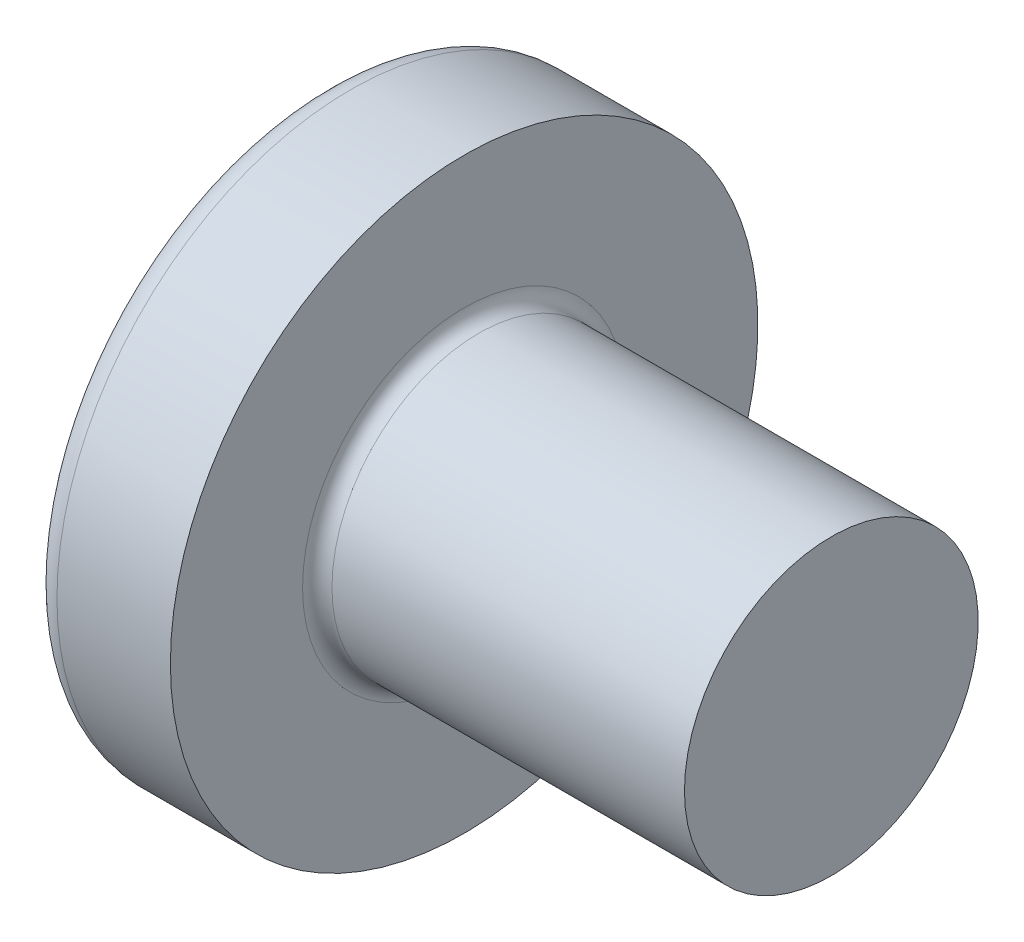
from build123d import *

# Parameters (mm, degrees)
FILLET1_R    = 0.2
RECPAT_COUNT = 2
RECPAT_ANGLE = 90


with BuildPart() as part:
    # BodySke → Base-Revolve (revolve)
    with BuildSketch(Plane.XY, mode=Mode.PRIVATE) as base_revolve_sk:
        with BuildLine():
            Line((3.1, 2), (3.1, 4))
            Line((3.1, 4), (1.555305874, 4))
            ThreePointArc((1.555305874, 4), (1.392873227, 3.961271902), (1.265388955, 3.853420195))
            ThreePointArc((1.265388955, 3.853420195), (0.324444487, 2.027933456), (0, 0))
            Line((0, 0), (8.1, 0))
            Line((8.1, 0), (8.1, 2))
            Line((8.1, 2), (3.1, 2))
        make_face()
    revolve(base_revolve_sk.sketch.rotate(Axis((1.555305874, 0, 0), (1, 0, 0)), 90), axis=Axis((1.555305874, 0, 0), (1, 0, 0)))

    # Fillet1
    fillet1_edges = [part.edges().sort_by_distance(p)[0] for p in [
        (3.1, 0, -2),
    ]]
    fillet(fillet1_edges, radius=FILLET1_R)

    # Sketch3 → Recess section 0
    with BuildSketch(Plane(origin=(0, 0, 0), x_dir=(0, 0, -1), z_dir=(1, 0, 0))):
        with BuildLine():
            Line((0.515, -2.15), (-0.515, -2.15))
            Line((-0.515, -2.15), (-0.515, 2.15))
            Line((-0.515, 2.15), (0.515, 2.15))
            Line((0.515, 2.15), (0.515, -2.15))
        make_face()
    # Sketch4 → Recess section 1
    with BuildSketch(Plane(origin=(2.34, 0, 0), x_dir=(0, 0, -1), z_dir=(1, 0, 0))):
        with BuildLine():
            Line((0.515, -0.983319232), (-0.515, -0.983319232))
            Line((-0.515, -0.983319232), (-0.515, 0.983319232))
            Line((-0.515, 0.983319232), (0.515, 0.983319232))
            Line((0.515, 0.983319232), (0.515, -0.983319232))
        make_face()
    recess = loft(mode=Mode.SUBTRACT)

    # RecPat: Recess ×2 about axis
    recpat_axis = Axis((0, 0, 0), (1, 0, 0))
    for i in range(1, RECPAT_COUNT):
        add(recess.rotate(recpat_axis, i * RECPAT_ANGLE / (RECPAT_COUNT - 1)), mode=Mode.SUBTRACT)

    # RecCorSke → RecessCore (revolve, cut)
    with BuildSketch(Plane.XY, mode=Mode.PRIVATE) as recesscore_sk:
        Polygon((0, 0), (0, 1.01462874), (2.34, 0.851), (2.616506661, 0), align=None)
    revolve(recesscore_sk.sketch.rotate(Axis((-3.175, 0, 0), (1, 0, 0)), 345.452408241), axis=Axis((-3.175, 0, 0), (1, 0, 0)), mode=Mode.SUBTRACT)


solid = part.part
